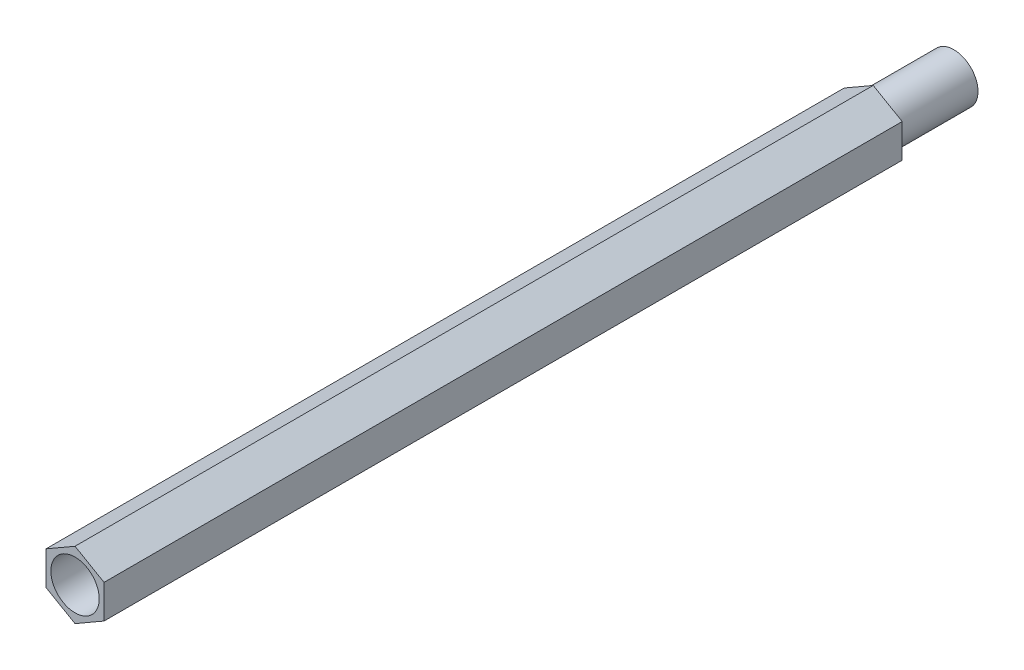
from build123d import *

# Parameters (mm, degrees)
SKETCH_1_R      = 1.5
EXTRUDE_1_DEPTH = 49.5
SKETCH_2_R      = 1.5
EXTRUDE_2_DEPTH = 5


with BuildPart() as part:
    # 草图1 → 凸台-拉伸1 (new body)
    with BuildSketch(Plane.XY):
        Polygon((0, 2.078460969), (-1.8, 1.039230485), (-1.8, -1.039230485), (0, -2.078460969), (1.8, -1.039230485), (1.8, 1.039230485), align=None)
        Circle(SKETCH_1_R, mode=Mode.SUBTRACT)
    extrude(amount=EXTRUDE_1_DEPTH)

    # 草图2 → 凸台-拉伸2 (add, symmetric)
    with BuildSketch(Plane(origin=(0, 0, 0), x_dir=(-1, 0, 0), z_dir=(0, 0, -1))):
        Circle(SKETCH_2_R)
    extrude(amount=EXTRUDE_2_DEPTH, both=True)


solid = part.part
